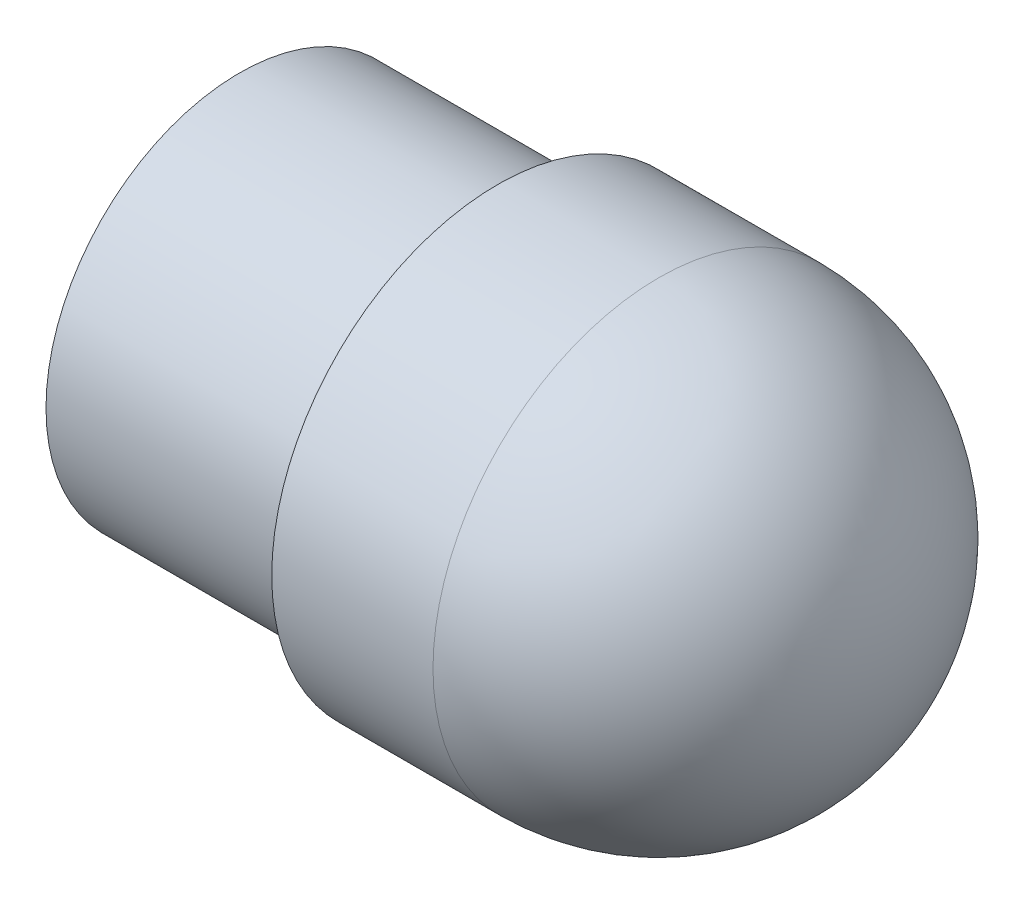
from build123d import *

# Parameters (mm, degrees)
SKETCH_1_W   = 12.5
SKETCH_1_H   = 17.5
SKETCH_1_W_2 = 20
SKETCH_1_H_2 = 15


with BuildPart() as part:
    # 草圖1 → 迴轉1 (revolve)
    with BuildSketch(Plane.XY, mode=Mode.PRIVATE) as revolve_1_sk:
        with Locations((26.25, 8.75)):
            Rectangle(SKETCH_1_W, SKETCH_1_H)
        with BuildLine():
            Line((32.5, 0), (50, 0))
            ThreePointArc((50, 0), (44.874368671, 12.374368671), (32.5, 17.5))
            Line((32.5, 17.5), (32.5, 0))
        make_face()
        with Locations((10, 7.5)):
            Rectangle(SKETCH_1_W_2, SKETCH_1_H_2)
    revolve(revolve_1_sk.sketch.rotate(Axis((0, 0, 0), (1, 0, 0)), 90), axis=Axis((0, 0, 0), (1, 0, 0)))


solid = part.part
